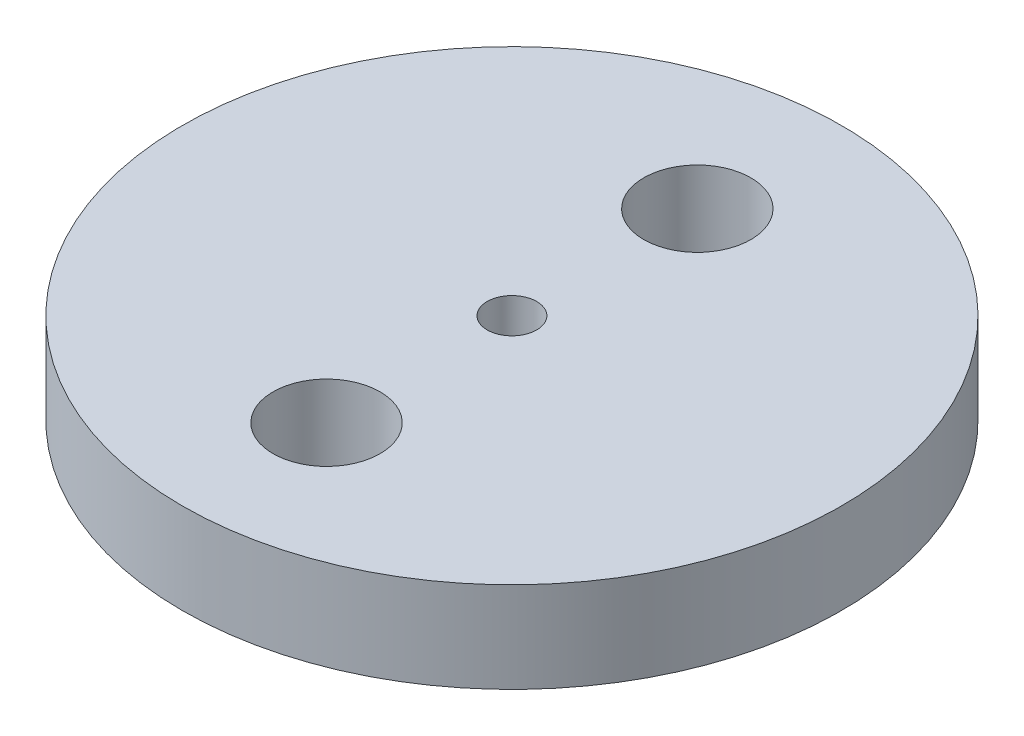
from build123d import *

# Parameters (mm, degrees)
SKETCH1_R           = 8
BOSS_EXTRUDE1_DEPTH = 2.2
SKETCH2_R           = 1.3
CUT_EXTRUDE1_DEPTH  = 2.2
SKETCH3_R           = 3
SKETCH3_R_2         = 2.45
BOSS_EXTRUDE2_DEPTH = 2.2
SKETCH8_R           = 0.6
CUT_EXTRUDE7_DEPTH  = 2.2


with BuildPart() as part:
    # Sketch1 → Boss-Extrude1 (new body)
    with BuildSketch(Plane(origin=(0, 0, 0), x_dir=(1, 0, 0), z_dir=(0, 1, 0))):
        with Locations(Location((0, 0, 0), (0, 0, 270))):
            Circle(SKETCH1_R)
    extrude(amount=BOSS_EXTRUDE1_DEPTH)

    # Sketch2 → Cut-Extrude1 (cut)
    with BuildSketch(Plane(origin=(0, 2.2, 0), x_dir=(1, 0, 0), z_dir=(0, 1, 0))):
        with Locations(Location((0, 4.5, 0), (0, 0, 270))):
            Circle(SKETCH2_R)
        with Locations(Location((0, -4.5, 0), (0, 0, 90))):
            Circle(SKETCH2_R)
    extrude(amount=-CUT_EXTRUDE1_DEPTH, mode=Mode.SUBTRACT)

    # Sketch3 → Boss-Extrude2 (add)
    with BuildSketch(Plane.XZ):
        with Locations(Location((0, 0, 0), (0, 0, 90))):
            Circle(SKETCH3_R)
        with Locations(Location((0, 0, 0), (0, 0, 270))):
            Circle(SKETCH3_R_2, mode=Mode.SUBTRACT)
    extrude(amount=BOSS_EXTRUDE2_DEPTH)

    # Sketch8 → Cut-Extrude7 (cut)
    with BuildSketch(Plane.XZ):
        with Locations(Location((0, 0, 0), (0, 0, 270))):
            Circle(SKETCH8_R)
    extrude(amount=-CUT_EXTRUDE7_DEPTH, mode=Mode.SUBTRACT)


solid = part.part
